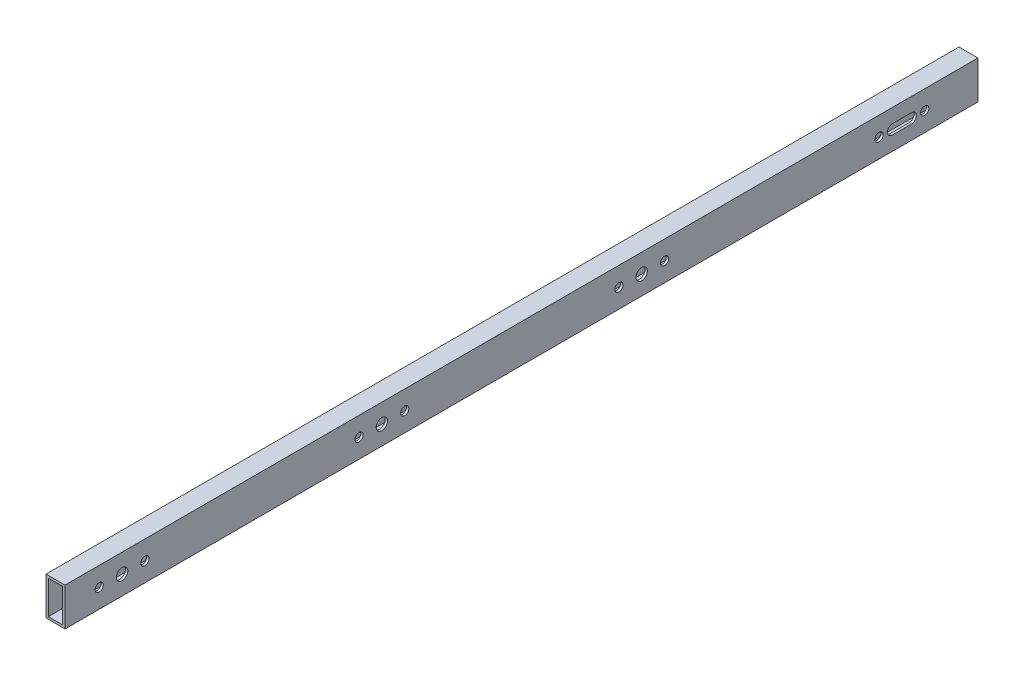
from build123d import *

# Parameters (mm, degrees)
SKETCH1_W           = 12.7
SKETCH1_H           = 25.4
SKETCH1_W_2         = 9.525
SKETCH1_H_2         = 22.225
BOSS_EXTRUDE1_DEPTH = 609.6
SKETCH2_R           = 3.81
SKETCH2_R_2         = 2.75
CUT_EXTRUDE1_DEPTH  = 610.86452594
CUT_EXTRUDE3_REACH  = 611.865
CUT_EXTRUDE5_REACH  = 612.162
SKETCH5_R           = 2.75


with BuildPart() as part:
    # Sketch1 → Boss-Extrude1 (new body)
    with BuildSketch(Plane.XY):
        Rectangle(SKETCH1_W, SKETCH1_H)
        Rectangle(SKETCH1_W_2, SKETCH1_H_2, mode=Mode.SUBTRACT)
    extrude(amount=BOSS_EXTRUDE1_DEPTH)

    # Sketch2 → Cut-Extrude1 (cut, through all)
    with BuildSketch(Plane(origin=(6.35, 0, 0), x_dir=(0, 0, -1), z_dir=(1, 0, 0))):
        with Locations((-571.5, 0)):
            Circle(SKETCH2_R)
        with Locations((-586.74, 0)):
            Circle(SKETCH2_R_2)
        with Locations((-556.26, 0)):
            Circle(SKETCH2_R_2)
        with Locations((-66.04, 0)):
            Circle(SKETCH2_R_2)
        with Locations((-35.56, 0)):
            Circle(SKETCH2_R_2)
        with Locations((-382.778, 0)):
            Circle(SKETCH2_R_2)
        with Locations((-398.018, 0)):
            Circle(SKETCH2_R)
        with Locations((-413.258, 0)):
            Circle(SKETCH2_R_2)
        with Locations((-209.296, 0)):
            Circle(SKETCH2_R_2)
        with Locations((-224.536, 0)):
            Circle(SKETCH2_R)
        with Locations((-239.776, 0)):
            Circle(SKETCH2_R_2)
        with BuildLine():
            Line((-44.45, -3.302), (-57.15, -3.302))
            ThreePointArc((-57.15, -3.302), (-60.452, 0), (-57.15, 3.302))
            Line((-57.15, 3.302), (-44.45, 3.302))
            ThreePointArc((-44.45, 3.302), (-41.148, 0), (-44.45, -3.302))
        make_face()
    extrude(amount=-CUT_EXTRUDE1_DEPTH, mode=Mode.SUBTRACT)

    # Sketch4 → Cut-Extrude3 (cut, up to next)
    with BuildSketch(Plane.ZY.offset(6.35), mode=Mode.PRIVATE) as cut_extrude3_sk1:
        with BuildLine():
            Line((35.56, 5), (66.04, 5))
            ThreePointArc((66.04, 5), (71.04, 0), (66.04, -5))
            Line((66.04, -5), (35.56, -5))
            ThreePointArc((35.56, -5), (30.56, 0), (35.56, 5))
        make_face()
    cut_extrude3_tool1 = extrude(cut_extrude3_sk1.sketch, amount=-CUT_EXTRUDE3_REACH, mode=Mode.PRIVATE) & part.part
    # Sketch4 → Cut-Extrude3 (cut, up to next)
    with BuildSketch(Plane.ZY.offset(6.35), mode=Mode.PRIVATE) as cut_extrude3_sk2:
        with BuildLine():
            Line((556.26, 5), (586.74, 5))
            ThreePointArc((586.74, 5), (591.74, 0), (586.74, -5))
            Line((586.74, -5), (556.26, -5))
            ThreePointArc((556.26, -5), (551.26, 0), (556.26, 5))
        make_face()
    cut_extrude3_tool2 = extrude(cut_extrude3_sk2.sketch, amount=-CUT_EXTRUDE3_REACH, mode=Mode.PRIVATE) & part.part
    # Sketch4 → Cut-Extrude3 (cut, up to next)
    with BuildSketch(Plane.ZY.offset(6.35), mode=Mode.PRIVATE) as cut_extrude3_sk3:
        with BuildLine():
            Line((209.042, 5), (239.522, 5))
            ThreePointArc((239.522, 5), (244.522, 0), (239.522, -5))
            Line((239.522, -5), (209.042, -5))
            ThreePointArc((209.042, -5), (204.042, 0), (209.042, 5))
        make_face()
    cut_extrude3_tool3 = extrude(cut_extrude3_sk3.sketch, amount=-CUT_EXTRUDE3_REACH, mode=Mode.PRIVATE) & part.part
    # Sketch4 → Cut-Extrude3 (cut, up to next)
    with BuildSketch(Plane.ZY.offset(6.35), mode=Mode.PRIVATE) as cut_extrude3_sk4:
        with BuildLine():
            Line((382.524, 5), (413.004, 5))
            ThreePointArc((413.004, 5), (418.004, 0), (413.004, -5))
            Line((413.004, -5), (382.524, -5))
            ThreePointArc((382.524, -5), (377.524, 0), (382.524, 5))
        make_face()
    cut_extrude3_tool4 = extrude(cut_extrude3_sk4.sketch, amount=-CUT_EXTRUDE3_REACH, mode=Mode.PRIVATE) & part.part
    add(cut_extrude3_tool1.solids().sort_by_distance((-6.35, 0, 50.8))[0], mode=Mode.SUBTRACT)
    add(cut_extrude3_tool2.solids().sort_by_distance((-6.35, 0, 571.5))[0], mode=Mode.SUBTRACT)
    add(cut_extrude3_tool3.solids().sort_by_distance((-6.35, 0, 224.282))[0], mode=Mode.SUBTRACT)
    add(cut_extrude3_tool4.solids().sort_by_distance((-6.35, 0, 397.764))[0], mode=Mode.SUBTRACT)

    # Sketch5 → Cut-Extrude5 (cut, up to next)
    with BuildSketch(Plane.XZ.offset(12.7), mode=Mode.PRIVATE) as cut_extrude5_sk1:
        with Locations(Location((0, 596.9, 0), (0, 0, 270))):
            Circle(SKETCH5_R)
    cut_extrude5_tool1 = extrude(cut_extrude5_sk1.sketch, amount=-CUT_EXTRUDE5_REACH, mode=Mode.PRIVATE) & part.part
    # Sketch5 → Cut-Extrude5 (cut, up to next)
    with BuildSketch(Plane.XZ.offset(12.7), mode=Mode.PRIVATE) as cut_extrude5_sk2:
        with Locations(Location((0, 12.7, 0), (0, 0, 270))):
            Circle(SKETCH5_R)
    cut_extrude5_tool2 = extrude(cut_extrude5_sk2.sketch, amount=-CUT_EXTRUDE5_REACH, mode=Mode.PRIVATE) & part.part
    add(cut_extrude5_tool1.solids().sort_by_distance((0, -12.7, 596.9))[0], mode=Mode.SUBTRACT)
    add(cut_extrude5_tool2.solids().sort_by_distance((0, -12.7, 12.7))[0], mode=Mode.SUBTRACT)


solid = part.part
